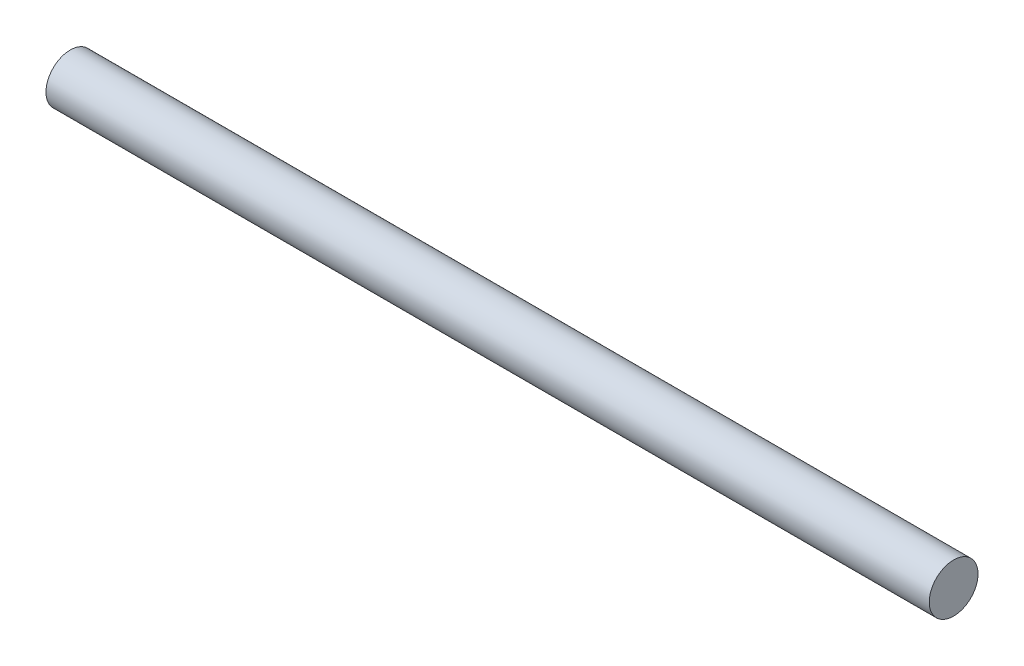
from build123d import *

# Parameters (mm, degrees)
SKETCH_1_R      = 4
EXTRUDE_1_DEPTH = 145


with BuildPart() as part:
    # 草图1 → 凸台-拉伸1 (new body)
    with BuildSketch(Plane(origin=(0, 0, 0), x_dir=(0, 0, -1), z_dir=(1, 0, 0))):
        Circle(SKETCH_1_R)
    extrude(amount=EXTRUDE_1_DEPTH)


solid = part.part
